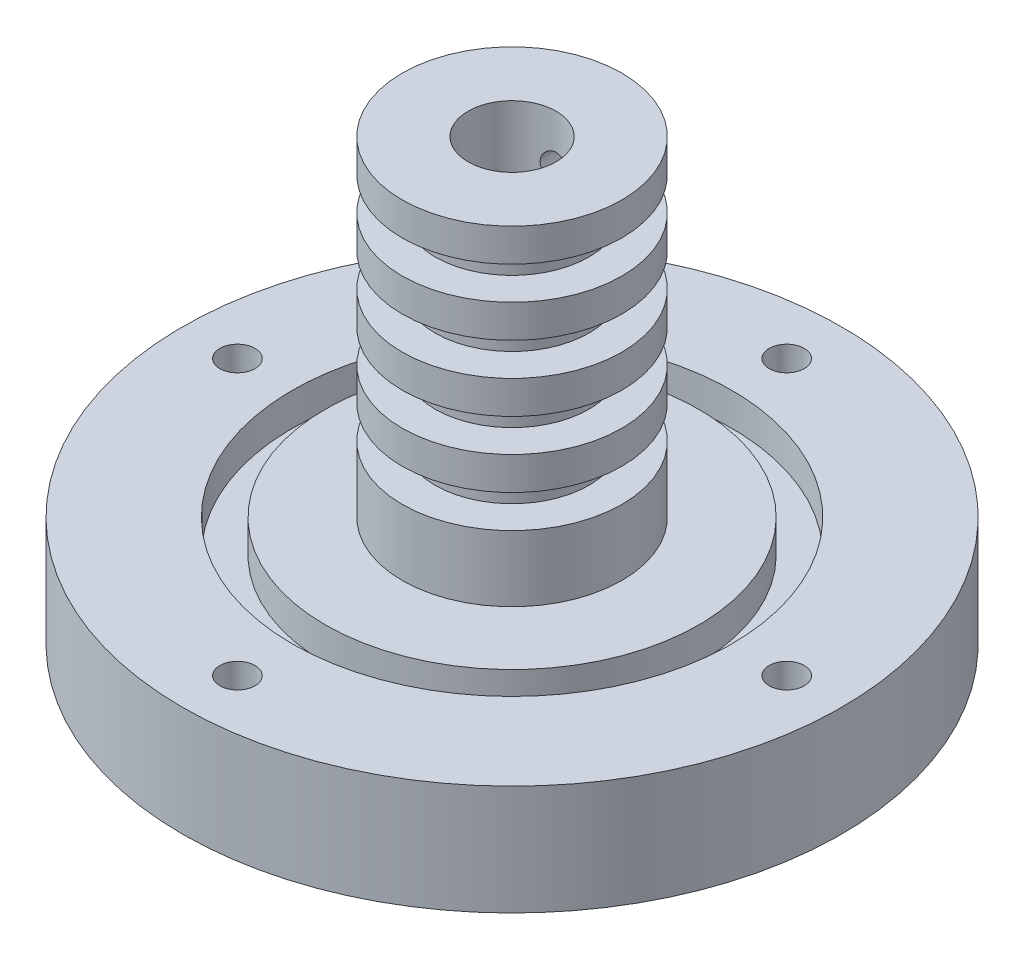
from build123d import *

# Parameters (mm, degrees)
SKETCH5_R          = 1.6
CUT_EXTRUDE2_DEPTH = 10
SKETCH8_R          = 1.25
CUT_EXTRUDE3_DEPTH = 10


with BuildPart() as part:
    # Sketch2 → Revolve1 (revolve)
    with BuildSketch(Plane.XY, mode=Mode.PRIVATE) as revolve1_sk:
        Polygon((4, 35.968329977), (4, -4.031670023), (30, -4.031670023), (30, 5.968329977), (20, 5.968329977), (20, 2.968329977), (17, 2.968329977), (17, 5.968329977), (10, 5.968329977), (10, 11.968329977), (7, 11.968329977), (7, 14.968329977), (10, 14.968329977), (10, 17.968329977), (7, 17.968329977), (7, 20.968329977), (10, 20.968329977), (10, 23.968329977), (7, 23.968329977), (7, 26.968329977), (10, 26.968329977), (10, 29.968329977), (7, 29.968329977), (7, 32.968329977), (10, 32.968329977), (10, 35.968329977), align=None)
    revolve(revolve1_sk.sketch.rotate(Axis((0, 37.555974624, 0), (0, -1, 0)), 90), axis=Axis((0, 37.555974624, 0), (0, -1, 0)))

    # Sketch5 → Cut-Extrude2 (cut)
    with BuildSketch(Plane(origin=(0, 5.968329977, 0), x_dir=(1, 0, 0), z_dir=(0, 1, 0))):
        with Locations(Location((-25, 0, 0), (0, 0, 270))):
            Circle(SKETCH5_R)
        with Locations(Location((0, 25, 0), (0, 0, 270))):
            Circle(SKETCH5_R)
        with Locations(Location((25, 0, 0), (0, 0, 270))):
            Circle(SKETCH5_R)
        with Locations(Location((0, -25, 0), (0, 0, 270))):
            Circle(SKETCH5_R)
    extrude(amount=-CUT_EXTRUDE2_DEPTH, mode=Mode.SUBTRACT)

    # Sketch8 → Cut-Extrude3 (cut)
    with BuildSketch(Plane.XY):
        with Locations((0, 31.468329977)):
            Circle(SKETCH8_R)
        with Locations((0, 25.468329977)):
            Circle(SKETCH8_R)
        with Locations((0, 19.468329977)):
            Circle(SKETCH8_R)
        with Locations((0, 13.468329977)):
            Circle(SKETCH8_R)
    extrude(amount=-CUT_EXTRUDE3_DEPTH, mode=Mode.SUBTRACT)


solid = part.part
